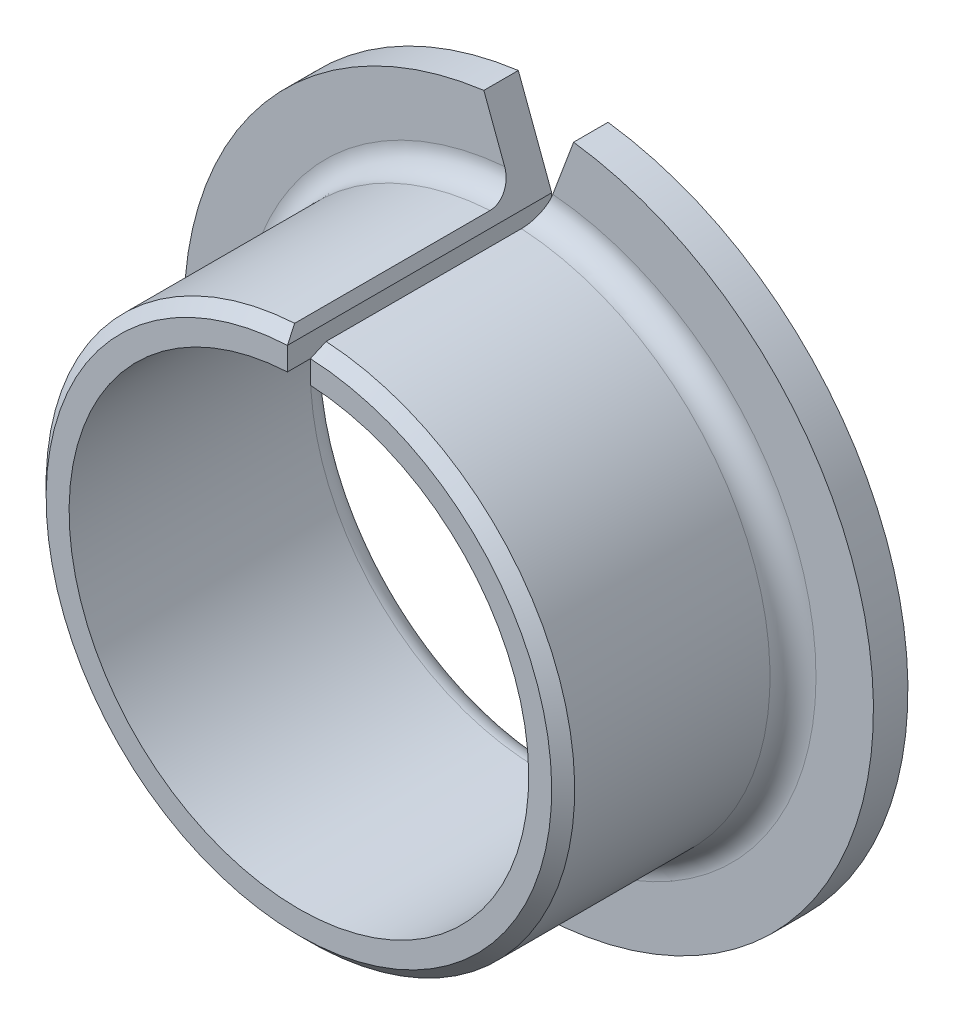
from build123d import *

# Parameters (mm, degrees)
ESQUISSE1_R             = 15
BOSS_EXTRU_1_DEPTH      = 11.5
ESQUISSE2_OUTSIDE_W     = 40.792
ESQUISSE2_OUTSIDE_H     = 40.792
ESQUISSE2_OUTSIDE_R     = 11.5
ENL_V_MAT_EXTRU_1_DEPTH = 10
ENL_V_MAT_EXTRU_2_REACH = 26.13
ESQUISSE3_R             = 10
CONG_1_R                = 1
CONG_2_R                = 1
ENL_V_MAT_EXTRU_3_DEPTH = 25.12985702402731
CHANFREIN1_SIZE         = 0.5


with BuildPart() as part:
    # Esquisse1 → Boss.-Extru.1 (new body)
    with BuildSketch(Plane.XY):
        Circle(ESQUISSE1_R)
    extrude(amount=BOSS_EXTRU_1_DEPTH)

    # Esquisse2 outside → Enlèv. mat.-Extru.1 (cut)
    with BuildSketch(Plane.XY.offset(11.5)):
        Rectangle(ESQUISSE2_OUTSIDE_W, ESQUISSE2_OUTSIDE_H)
        Circle(ESQUISSE2_OUTSIDE_R, mode=Mode.SUBTRACT)
    extrude(amount=-ENL_V_MAT_EXTRU_1_DEPTH, mode=Mode.SUBTRACT)

    # Esquisse3 → Enlèv. mat.-Extru.2 (cut, up to next)
    with BuildSketch(Plane.XY.offset(11.5), mode=Mode.PRIVATE) as enl_v_mat_extru_2_sk1:
        Circle(ESQUISSE3_R)
    enl_v_mat_extru_2_tool1 = extrude(enl_v_mat_extru_2_sk1.sketch, amount=-ENL_V_MAT_EXTRU_2_REACH, mode=Mode.PRIVATE) & part.part
    add(enl_v_mat_extru_2_tool1.solids().sort_by_distance((0, 0, 11.5))[0], mode=Mode.SUBTRACT)

    # Congé1
    cong_1_edges = [part.edges().sort_by_distance(p)[0] for p in [
        (-11.5, 1.41e-15, 1.5),
    ]]
    fillet(cong_1_edges, radius=CONG_1_R)

    # Congé2
    cong_2_edges = [part.edges().sort_by_distance(p)[0] for p in [
        (-10, 1.22e-15, 0),
    ]]
    fillet(cong_2_edges, radius=CONG_2_R)

    # Esquisse4 → Enlèv. mat.-Extru.3 (cut, through all)
    with BuildSketch(Plane.XY.offset(11.5)):
        Polygon((0.5, 9), (-0.5, 9), (-0.5, 10.988630487917954), (-2.0000000000000004, 15), (2, 15), (0.5, 10.988630487917954), align=None)
    extrude(amount=-ENL_V_MAT_EXTRU_3_DEPTH, mode=Mode.SUBTRACT)

    # Chanfrein1
    chanfrein1_edges = [part.edges().sort_by_distance(p)[0] for p in [
        (-7.886330667871463, -8.36993360768113, 11.5),
    ]]
    chamfer(chanfrein1_edges, length=CHANFREIN1_SIZE)


solid = part.part
